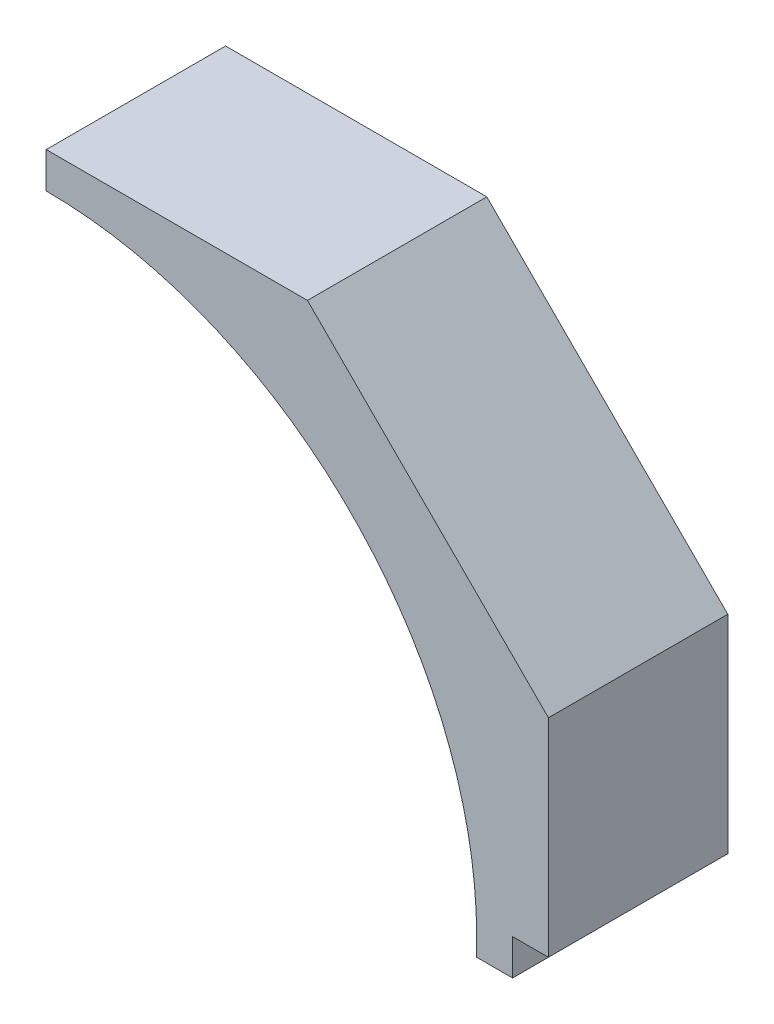
from build123d import *

# Parameters (mm, degrees)
BOSS_EXTRUDE2_DEPTH = 12.7
SKETCH3_W           = 5.08
SKETCH3_H           = 25.4
CUT_EXTRUDE1_DEPTH  = 52.992503306
BOSS_EXTRUDE3_DEPTH = 12.7


with BuildPart() as part:
    # Sketch2 → Boss-Extrude2 (new body)
    with BuildSketch(Plane.XY):
        with BuildLine():
            Line((0, 30.48), (0, 33.02))
            Line((0, 33.02), (18.49751337, 33.02))
            Line((18.49751337, 33.02), (35.56, 15.95751337))
            Line((35.56, 15.95751337), (38.1, -1.27))
            Line((38.1, -1.27), (35.56, -1.27))
            Line((35.56, -1.27), (30.48, -1.27))
            Line((30.48, -1.27), (30.48, 0))
            ThreePointArc((30.48, 0), (21.552614691, 21.552614691), (0, 30.48))
        make_face()
    extrude(amount=BOSS_EXTRUDE2_DEPTH)

    # Sketch3 → Cut-Extrude1 (cut, through all)
    with BuildSketch(Plane.XY.offset(12.7)):
        with Locations((35.56, 11.43)):
            Rectangle(SKETCH3_W, SKETCH3_H)
    extrude(amount=-CUT_EXTRUDE1_DEPTH, mode=Mode.SUBTRACT)

    # Sketch4 → Boss-Extrude3 (add)
    with BuildSketch(Plane.XY.offset(12.7)):
        Polygon((33.02, 1.27), (35.56, 1.27), (35.56, 15.95751337), (33.02, 18.49751337), align=None)
    extrude(amount=-BOSS_EXTRUDE3_DEPTH)


solid = part.part
